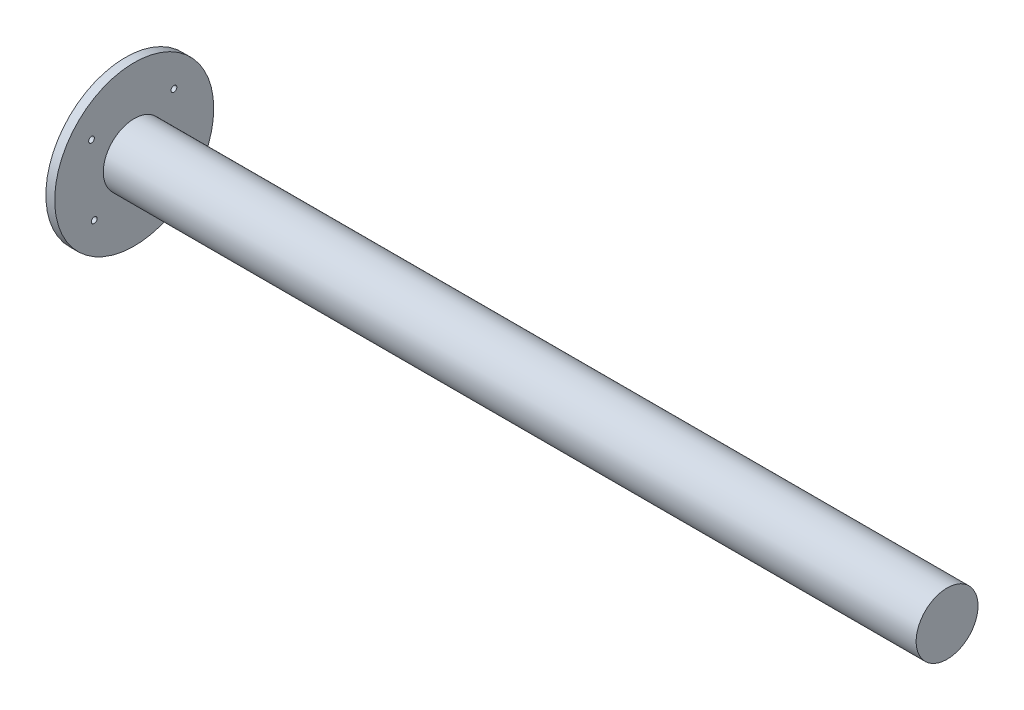
from build123d import *

# Parameters (mm, degrees)
CROQUIS1_R                      = 45
SALIENTE_EXTRUIR1_DEPTH         = 5
CROQUIS2_R                      = 17.5
SALIENTE_EXTRUIR2_DEPTH         = 460
TALADRO_DE_MARGEN_PARA_45_D     = 3.2639
TALADRO_DE_MARGEN_PARA_45_DEPTH = 5
TALADRO_DE_MARGEN_PARA_45_TIP   = 0.980574487


with BuildPart() as part:
    # Croquis1 → Saliente-Extruir1 (new body)
    with BuildSketch(Plane(origin=(0, 0, 0), x_dir=(0, 0, -1), z_dir=(1, 0, 0))):
        Circle(CROQUIS1_R)
    extrude(amount=SALIENTE_EXTRUIR1_DEPTH)

    # Croquis2 → Saliente-Extruir2 (add)
    with BuildSketch(Plane(origin=(5, 0, 0), x_dir=(0, 0, -1), z_dir=(1, 0, 0))):
        Circle(CROQUIS2_R)
    extrude(amount=SALIENTE_EXTRUIR2_DEPTH)

    # Taladro de margen para #45
    with Locations(Plane.ZY):
        with Locations((24.168284878, 19.253675131), (-22.486191371, 20.842427824), (-23.790363973, -19.467053758), (22.632872333, -20.978386258)):
            Hole(TALADRO_DE_MARGEN_PARA_45_D / 2, depth=TALADRO_DE_MARGEN_PARA_45_DEPTH)
            with Locations((0, 0, -(TALADRO_DE_MARGEN_PARA_45_DEPTH + TALADRO_DE_MARGEN_PARA_45_TIP / 2))):  # 118° drill point
                Cone(0, TALADRO_DE_MARGEN_PARA_45_D / 2, TALADRO_DE_MARGEN_PARA_45_TIP, mode=Mode.SUBTRACT)


solid = part.part
